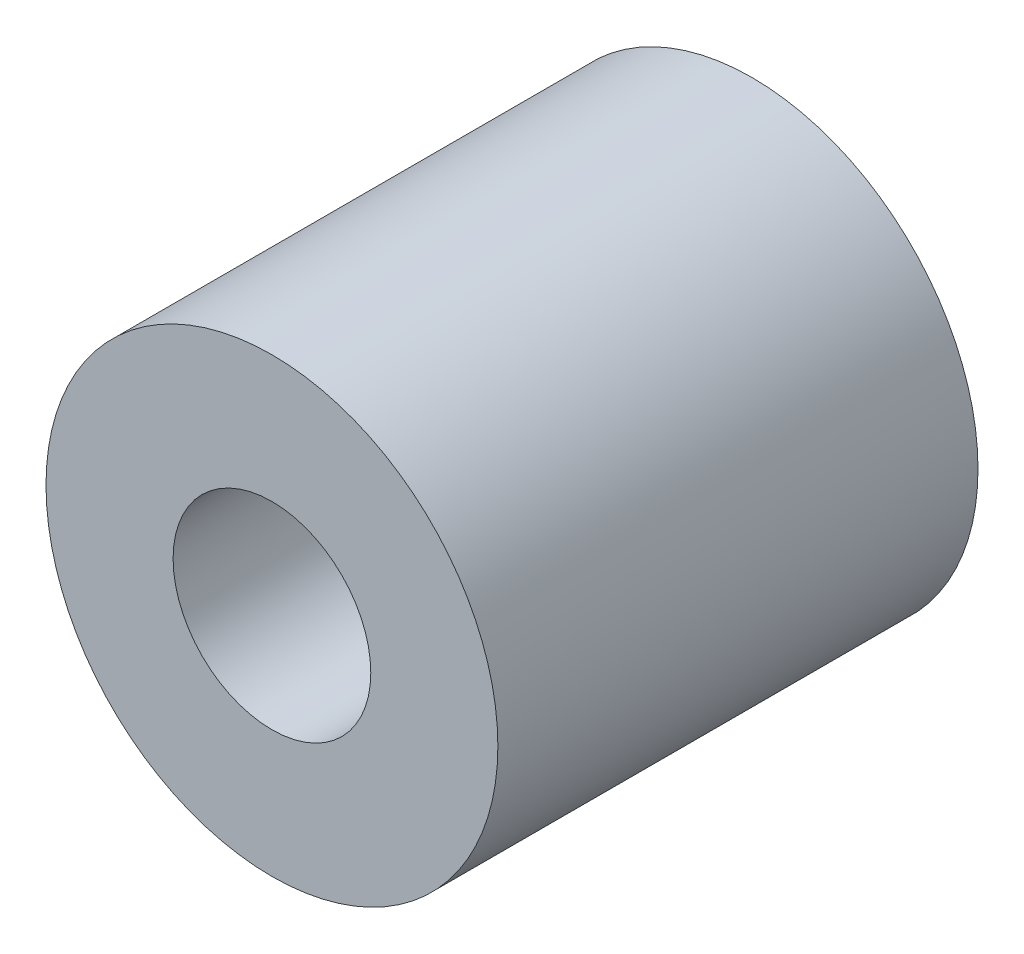
from build123d import *

# Parameters (mm, degrees)
SKETCH_1_R      = 4
SKETCH_1_R_2    = 1.75
EXTRUDE_1_DEPTH = 8.5


with BuildPart() as part:
    # 草图1 → 凸台-拉伸1 (new body)
    with BuildSketch(Plane.XY):
        Circle(SKETCH_1_R)
        Circle(SKETCH_1_R_2, mode=Mode.SUBTRACT)
    extrude(amount=EXTRUDE_1_DEPTH)


solid = part.part
